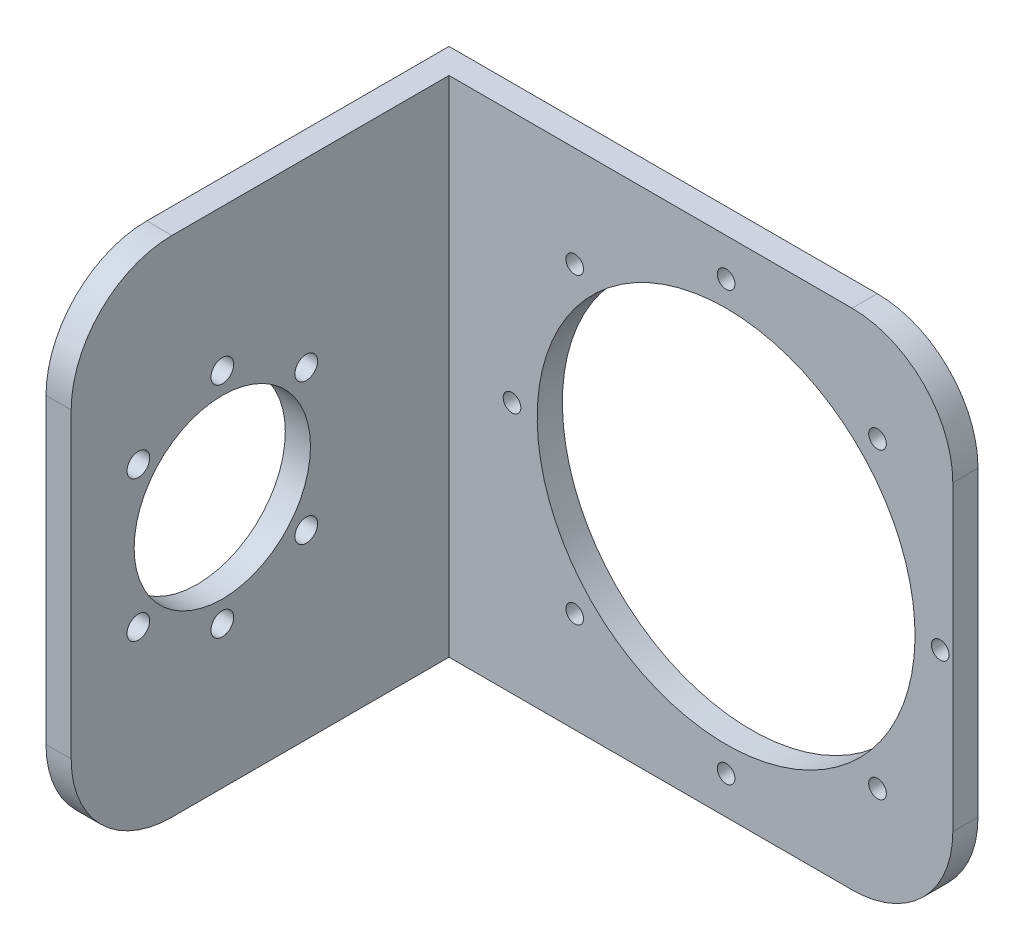
from build123d import *

# Parameters (mm, degrees)
SKETCH_1_W          = 80
SKETCH_1_H          = 100
EXTRUDE_1_DEPTH     = 5
SKETCH_3_W          = 5
SKETCH_3_H          = 100
EXTRUDE_2_DEPTH     = 100
SKETCH_4_R          = 2.25
SKETCH_4_R_2        = 17.5
CUT_EXTRUDE_1_DEPTH = 100
SKETCH_5_R          = 1.75
SKETCH_5_R_2        = 37.5
CUT_EXTRUDE_2_DEPTH = 22
FILLET_1_R          = 20


with BuildPart() as part:
    # 草图1 → 凸台-拉伸1 (new body)
    with BuildSketch(Plane(origin=(0, 0, 0), x_dir=(0, 0, -1), z_dir=(1, 0, 0))):
        Rectangle(SKETCH_1_W, SKETCH_1_H)
    extrude(amount=EXTRUDE_1_DEPTH)

    # 草图3 → 凸台-拉伸2 (add)
    with BuildSketch(Plane(origin=(5, 0, 0), x_dir=(0, 0, -1), z_dir=(1, 0, 0))):
        with Locations((37.5, 0)):
            Rectangle(SKETCH_3_W, SKETCH_3_H)
    extrude(amount=EXTRUDE_2_DEPTH)

    # 草图4 → 切除-拉伸1 (cut)
    with BuildSketch(Plane.ZY):
        with Locations((10, 21.75)):
            Circle(SKETCH_4_R)
        with Locations((26.661466638, 13.980630511)):
            Circle(SKETCH_4_R)
        with Locations(Location((-6.661466638, 13.980630511, 0), (0, 0, 180))):
            Circle(SKETCH_4_R)
        with Locations(Location((10, -21.75, 0), (0, 0, 180))):
            Circle(SKETCH_4_R)
        with Locations(Location((26.661466638, -13.980630511, 0), (0, 0, 180))):
            Circle(SKETCH_4_R)
        with Locations((-6.661466638, -13.980630511)):
            Circle(SKETCH_4_R)
        with Locations((10, 0)):
            Circle(SKETCH_4_R_2)
    extrude(amount=-CUT_EXTRUDE_1_DEPTH, mode=Mode.SUBTRACT)

    # 草图5 → 切除-拉伸2 (cut)
    with BuildSketch(Plane(origin=(0, 0, -40), x_dir=(-1, 0, 0), z_dir=(0, 0, -1))):
        with Locations(Location((-60, 42.5, 0), (0, 0, 90))):
            Circle(SKETCH_5_R)
        with Locations(Location((-29.9479618, 30.0520382, 0), (0, 0, 90))):
            Circle(SKETCH_5_R)
        with Locations(Location((-17.5, 0, 0), (0, 0, 90))):
            Circle(SKETCH_5_R)
        with Locations(Location((-29.9479618, -30.0520382, 0), (0, 0, 90))):
            Circle(SKETCH_5_R)
        with Locations(Location((-60, -42.5, 0), (0, 0, 90))):
            Circle(SKETCH_5_R)
        with Locations(Location((-90.0520382, -30.0520382, 0), (0, 0, 90))):
            Circle(SKETCH_5_R)
        with Locations(Location((-102.5, 0, 0), (0, 0, 90))):
            Circle(SKETCH_5_R)
        with Locations(Location((-90.0520382, 30.0520382, 0), (0, 0, 90))):
            Circle(SKETCH_5_R)
        with Locations(Location((-60, 0, 0), (0, 0, 90))):
            Circle(SKETCH_5_R_2)
    extrude(amount=-CUT_EXTRUDE_2_DEPTH, mode=Mode.SUBTRACT)

    # 圆角1
    fillet_1_edges = [part.edges().sort_by_distance(p)[0] for p in [
        (105, 50, -37.5),
        (105, -50, -37.5),
        (2.5, 50, 40),
        (2.5, -50, 40),
    ]]
    fillet(fillet_1_edges, radius=FILLET_1_R)


solid = part.part
